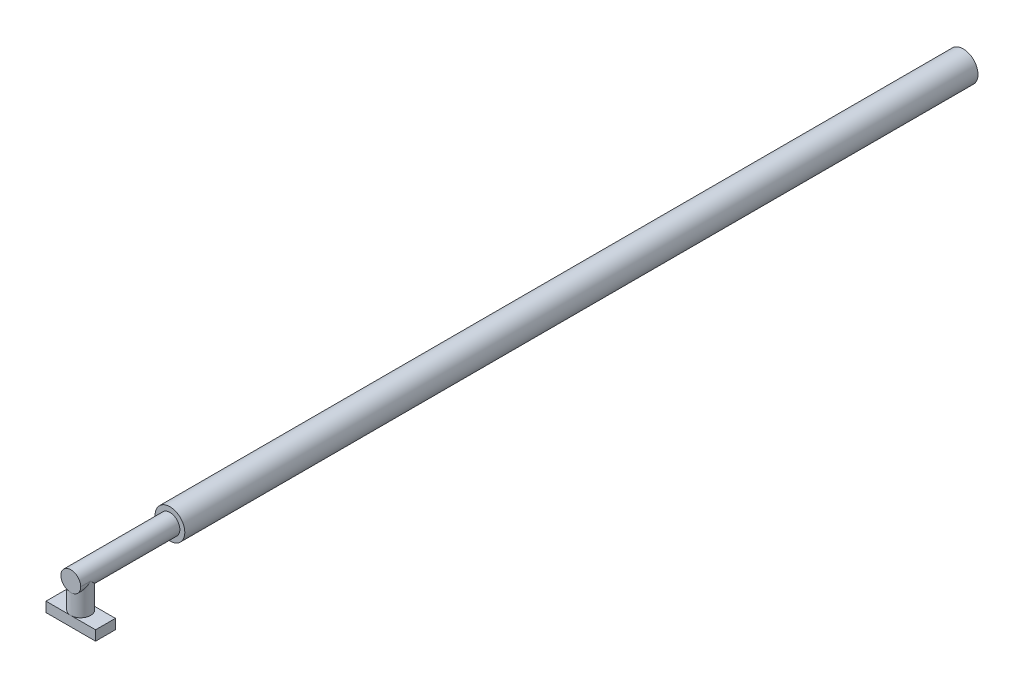
from build123d import *

# Parameters (mm, degrees)
SKETCH_2_R      = 10
EXTRUDE_1_DEPTH = 30
SKETCH_3_W      = 50
SKETCH_3_H      = 20
EXTRUDE_2_DEPTH = 10


with BuildPart() as part:
    # Эскиз1 → Повернуть1 (revolve)
    with BuildSketch(Plane(origin=(0, 0, 0), x_dir=(0, 0, -1), z_dir=(1, 0, 0)), mode=Mode.PRIVATE) as revolve_1_sk:
        Polygon((0, 0), (0, 10), (100, 10), (100, 15), (900, 15), (900, 0), align=None)
    revolve(revolve_1_sk.sketch.rotate(Axis((0, 0, 0), (0, 0, -1)), 90), axis=Axis((0, 0, 0), (0, 0, -1)))

    # Эскиз2 → Бобышка-Вытянуть1 (add)
    with BuildSketch(Plane(origin=(0, 0, 0), x_dir=(1, 0, 0), z_dir=(0, 1, 0))):
        with Locations(Location((0, 10, 0), (0, 0, 270))):
            Circle(SKETCH_2_R)
    extrude(amount=-EXTRUDE_1_DEPTH)

    # Эскиз3 → Бобышка-Вытянуть2 (add)
    with BuildSketch(Plane.XZ.offset(30)):
        with Locations((0, -10)):
            Rectangle(SKETCH_3_W, SKETCH_3_H)
    extrude(amount=EXTRUDE_2_DEPTH)


solid = part.part
